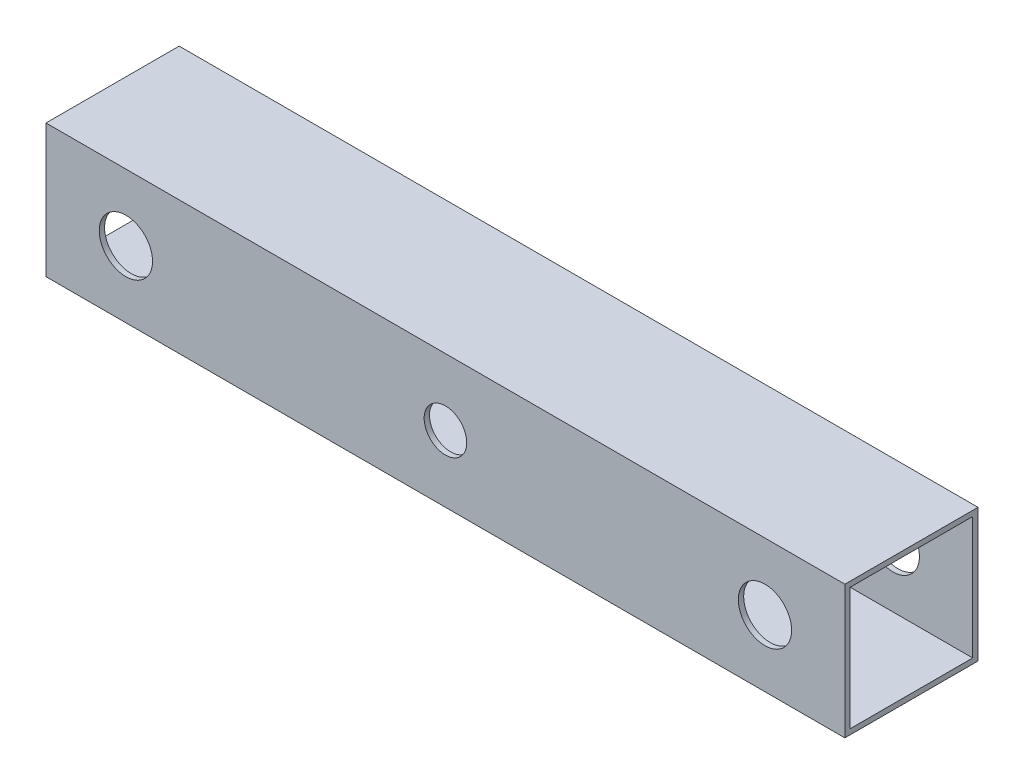
from build123d import *

# Parameters (mm, degrees)
SKETCH1_W           = 25
SKETCH1_H           = 25
SKETCH1_W_2         = 23
SKETCH1_H_2         = 23
BOSS_EXTRUDE1_DEPTH = 150
SKETCH2_R           = 4
SKETCH2_R_2         = 5
CUT_EXTRUDE1_DEPTH  = 153.581945197


with BuildPart() as part:
    # Sketch1 → Boss-Extrude1 (new body)
    with BuildSketch(Plane(origin=(0, 0, 0), x_dir=(0, 0, -1), z_dir=(1, 0, 0))):
        Rectangle(SKETCH1_W, SKETCH1_H)
        Rectangle(SKETCH1_W_2, SKETCH1_H_2, mode=Mode.SUBTRACT)
    extrude(amount=BOSS_EXTRUDE1_DEPTH)

    # Sketch2 → Cut-Extrude1 (cut, through all)
    with BuildSketch(Plane.XY.offset(12.5)):
        with Locations((75, 0)):
            Circle(SKETCH2_R)
        with Locations((15, 0)):
            Circle(SKETCH2_R_2)
        with Locations((135, 0)):
            Circle(SKETCH2_R_2)
    extrude(amount=-CUT_EXTRUDE1_DEPTH, mode=Mode.SUBTRACT)


solid = part.part
